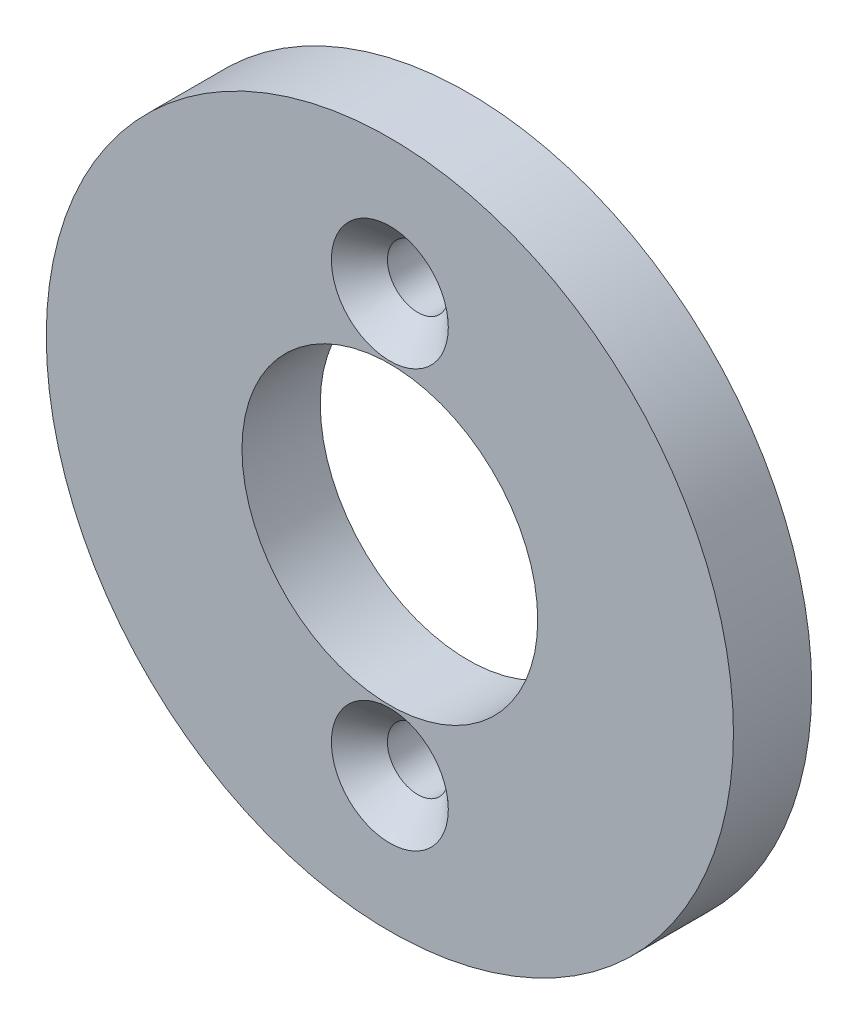
from build123d import *

# Parameters (mm, degrees)
SKETCH_1_R                    = 39.5
EXTRUDE_1_DEPTH               = 9
CUT_EXTRUDE_1_DEPTH           = 57.581799194
CUT_EXTRUDE_1_DEPTH_BACK      = 57.581799194
SKETCH_2_R                    = 17
SKETCH_2_R_2                  = 3.5
SKETCH_3_R                    = 6.72
CUT_EXTRUDE_2_DEPTH           = 3.22
CUT_EXTRUDE_2_DRAFT           = -45
CUT_EXTRUDE_2_PROFILE_2_DEPTH = 3.22
CUT_EXTRUDE_2_PROFILE_2_DRAFT = -45


with BuildPart() as part:
    # ｽｹｯﾁ1 → ﾎﾞｽ - 押し出し1 (new body)
    with BuildSketch(Plane.XY):
        Circle(SKETCH_1_R)
    extrude(amount=EXTRUDE_1_DEPTH)

    # ｽｹｯﾁ2 → ｶｯﾄ - 押し出し1 (cut, two sides: drawn at the far end of the back side and taken through both)
    with BuildSketch(Plane.XY.offset(-CUT_EXTRUDE_1_DEPTH_BACK)):
        Circle(SKETCH_2_R)
        with Locations((0, 24)):
            Circle(SKETCH_2_R_2)
        with Locations((0, -24)):
            Circle(SKETCH_2_R_2)
    extrude(amount=CUT_EXTRUDE_1_DEPTH + CUT_EXTRUDE_1_DEPTH_BACK, mode=Mode.SUBTRACT)


with BuildPart() as cut_extrude_2_tool:
    # ｽｹｯﾁ3 → ｶｯﾄ - 押し出し2 (with draft: the straight prism first)
    with BuildSketch(Plane.XY.offset(9)):
        with Locations((0, 24)):
            Circle(SKETCH_3_R)
    extrude(amount=-CUT_EXTRUDE_2_DEPTH)
    # ｶｯﾄ - 押し出し2: the draft: its side faces are tilted about the plane it starts from
    cut_extrude_2_sides = [cut_extrude_2_tool.faces().sort_by_distance(p)[0] for p in [
        (-6.72, 24, 7.39),
    ]]
    draft(cut_extrude_2_sides, Plane.XY.offset(9), CUT_EXTRUDE_2_DRAFT)


with BuildPart() as part_1:
    add(part.part)

    # ｶｯﾄ - 押し出し2: cut by cut_extrude_2_tool
    add(cut_extrude_2_tool.part, mode=Mode.SUBTRACT)


with BuildPart() as cut_extrude_2_profile_2_tool:
    # ｽｹｯﾁ3 → ｶｯﾄ - 押し出し2 profile 2 (with draft: the straight prism first)
    with BuildSketch(Plane.XY.offset(9)):
        with Locations((0, -24)):
            Circle(SKETCH_3_R)
    extrude(amount=-CUT_EXTRUDE_2_PROFILE_2_DEPTH)
    # ｶｯﾄ - 押し出し2 profile 2: the draft: its side faces are tilted about the plane it starts from
    cut_extrude_2_profile_2_sides = [cut_extrude_2_profile_2_tool.faces().sort_by_distance(p)[0] for p in [
        (-6.72, -24, 7.39),
    ]]
    draft(cut_extrude_2_profile_2_sides, Plane.XY.offset(9), CUT_EXTRUDE_2_PROFILE_2_DRAFT)


with BuildPart() as part_2:
    add(part_1.part)

    # ｶｯﾄ - 押し出し2 profile 2: cut by cut_extrude_2_profile_2_tool
    add(cut_extrude_2_profile_2_tool.part, mode=Mode.SUBTRACT)


solid = part_2.part
